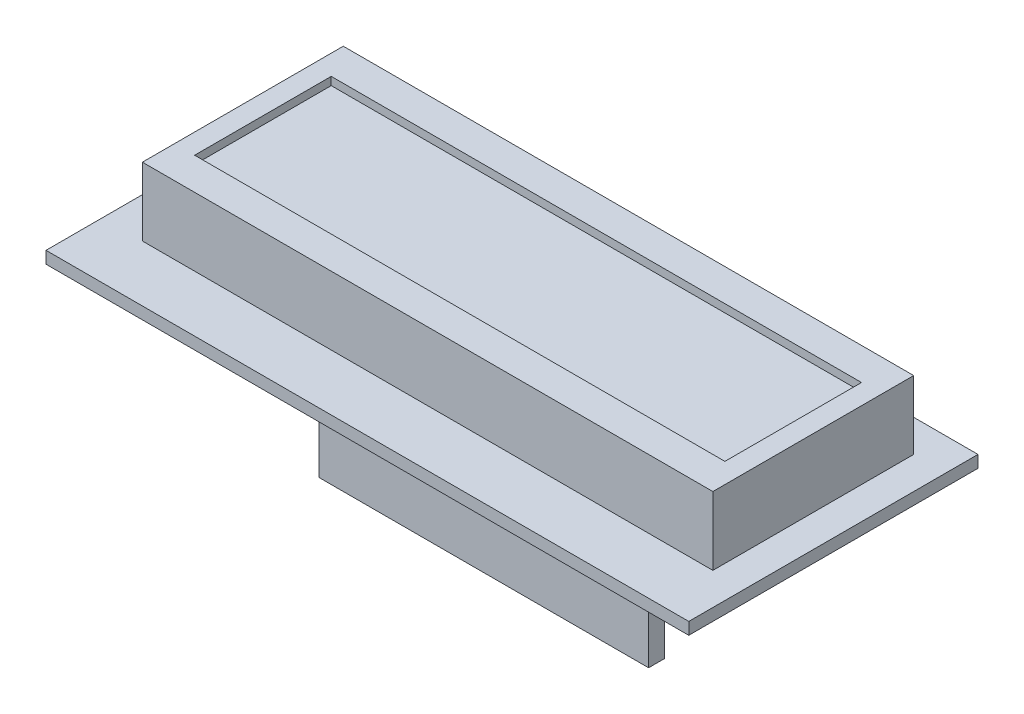
from build123d import *

# Parameters (mm, degrees)
ESQUISSE1_W             = 8
ESQUISSE1_H             = 3.6
BOSS_EXTRU_1_DEPTH      = 0.15
ESQUISSE2_W             = 7.1
ESQUISSE2_H             = 2.5
BOSS_EXTRU_2_DEPTH      = 0.85
ESQUISSE3_W             = 4.1
ESQUISSE3_H             = 0.2
BOSS_EXTRU_3_DEPTH      = 0.7
ESQUISSE4_W             = 6.6
ESQUISSE4_H             = 1.7
ENL_V_MAT_EXTRU_1_DEPTH = 0.1


with BuildPart() as part:
    # Esquisse1 → Boss.-Extru.1 (new body)
    with BuildSketch(Plane(origin=(0, 0, 0), x_dir=(1, 0, 0), z_dir=(0, 1, 0))):
        Rectangle(ESQUISSE1_W, ESQUISSE1_H)
    extrude(amount=BOSS_EXTRU_1_DEPTH)

    # Esquisse2 → Boss.-Extru.2 (add)
    with BuildSketch(Plane(origin=(0, 0.15, 0), x_dir=(1, 0, 0), z_dir=(0, 1, 0))):
        with Locations((0.05, 0.15)):
            Rectangle(ESQUISSE2_W, ESQUISSE2_H)
    extrude(amount=BOSS_EXTRU_2_DEPTH)

    # Esquisse3 → Boss.-Extru.3 (add)
    with BuildSketch(Plane.XZ):
        with Locations((1.35, 1.6)):
            Rectangle(ESQUISSE3_W, ESQUISSE3_H)
    extrude(amount=BOSS_EXTRU_3_DEPTH)

    # Esquisse4 → Enlèv. mat.-Extru.1 (cut)
    with BuildSketch(Plane(origin=(0, 1, 0), x_dir=(1, 0, 0), z_dir=(0, 1, 0))):
        with Locations((0.05, 0.15)):
            Rectangle(ESQUISSE4_W, ESQUISSE4_H)
    extrude(amount=-ENL_V_MAT_EXTRU_1_DEPTH, mode=Mode.SUBTRACT)


solid = part.part
